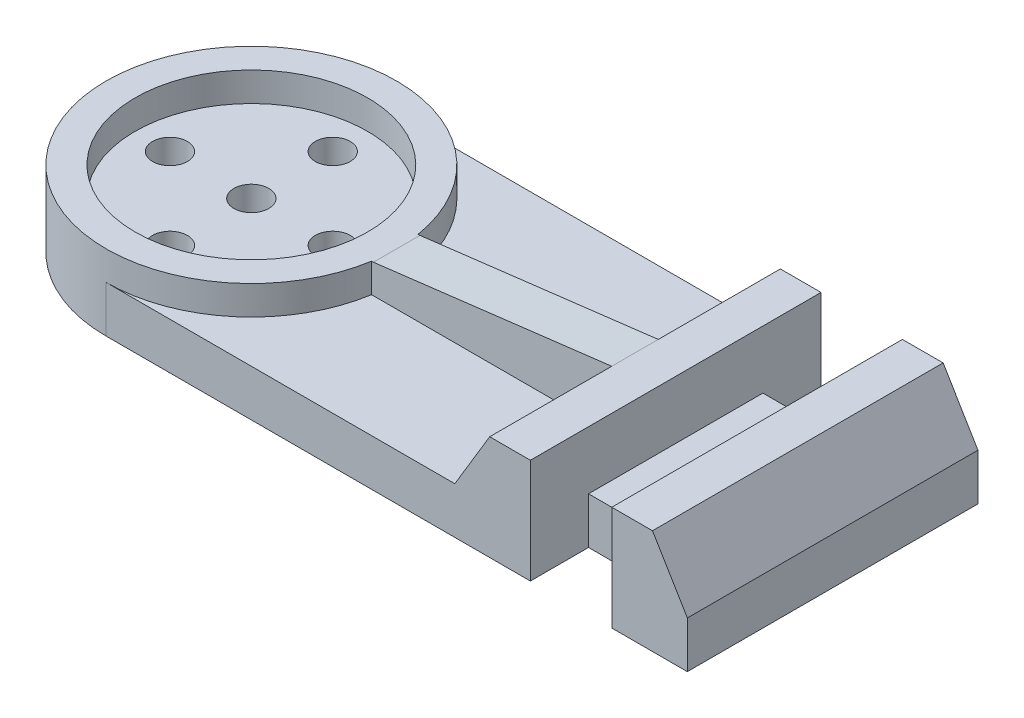
from build123d import *

# Parameters (mm, degrees)
SKETCH_1_R          = 12.5
EXTRUDE_1_DEPTH     = 4
SKETCH_2_R          = 12.5
SKETCH_2_R_2        = 10
EXTRUDE_2_DEPTH     = 2.5
SKETCH_3_R          = 1.5
CUT_EXTRUDE_1_DEPTH = 52.947088465
EXTRUDE_3_DEPTH     = 25
SKETCH_5_W          = 7
SKETCH_5_H          = 5
CUT_EXTRUDE_2_DEPTH = 57.621550668
SKETCH_6_W          = 7
SKETCH_6_H          = 5
CUT_EXTRUDE_3_DEPTH = 52.780787943
EXTRUDE_6_DEPTH     = 2


with BuildPart() as part:
    # 草图1 → 凸台-拉伸1 (new body)
    with BuildSketch(Plane(origin=(0, 0, 0), x_dir=(1, 0, 0), z_dir=(0, 1, 0))):
        Circle(SKETCH_1_R)
        with BuildLine():
            Line((50, 12.5), (0, 12.5))
            ThreePointArc((0, 12.5), (8.838834765, 8.838834765), (12.5, 0))
            ThreePointArc((12.5, 0), (8.838834765, -8.838834765), (0, -12.5))
            Line((0, -12.5), (50, -12.5))
            Line((50, -12.5), (50, 12.5))
        make_face()
    extrude(amount=EXTRUDE_1_DEPTH)

    # 草图2 → 凸台-拉伸2 (add)
    with BuildSketch(Plane(origin=(0, 4, 0), x_dir=(1, 0, 0), z_dir=(0, 1, 0))):
        with Locations(Location((0, 0, 0), (0, 0, 270))):
            Circle(SKETCH_2_R)
        with Locations(Location((0, 0, 0), (0, 0, 270))):
            Circle(SKETCH_2_R_2, mode=Mode.SUBTRACT)
    extrude(amount=EXTRUDE_2_DEPTH)

    # 草图3 → 切除-拉伸1 (cut, through all)
    with BuildSketch(Plane.XZ):
        with Locations(Location((0, 0, 0), (0, 0, 270))):
            Circle(SKETCH_3_R)
        with Locations(Location((0, 7, 0), (0, 0, 270))):
            Circle(SKETCH_3_R)
        with Locations(Location((7, 0, 0), (0, 0, 270))):
            Circle(SKETCH_3_R)
        with Locations(Location((0, -7, 0), (0, 0, 270))):
            Circle(SKETCH_3_R)
        with Locations(Location((-7, 0, 0), (0, 0, 270))):
            Circle(SKETCH_3_R)
        with Locations(Location((40, 0, 0), (0, 0, 270))):
            Circle(SKETCH_3_R)
    extrude(amount=-CUT_EXTRUDE_1_DEPTH, mode=Mode.SUBTRACT)

    # 草图4 → 凸台-拉伸3 (add)
    with BuildSketch(Plane.XY.offset(12.5)):
        Polygon((50, 4), (47, 9), (33, 9), (30, 4), align=None)
    extrude(amount=-EXTRUDE_3_DEPTH)

    # 草图5 → 切除-拉伸2 (cut, through all)
    with BuildSketch(Plane.XY.offset(12.5)):
        with Locations((40, 6.5)):
            Rectangle(SKETCH_5_W, SKETCH_5_H)
    extrude(amount=-CUT_EXTRUDE_2_DEPTH, mode=Mode.SUBTRACT)

    # 草图6 → 切除-拉伸3 (cut, through all)
    with BuildSketch(Plane(origin=(0, 4, 0), x_dir=(1, 0, 0), z_dir=(0, 1, 0))):
        with Locations((40, -10)):
            Rectangle(SKETCH_6_W, SKETCH_6_H)
        with Locations((40, 10)):
            Rectangle(SKETCH_6_W, SKETCH_6_H)
    extrude(amount=-CUT_EXTRUDE_3_DEPTH, mode=Mode.SUBTRACT)

    # 草图7 → 凸台-拉伸6 (add, symmetric)
    with BuildSketch(Plane.XY):
        Polygon((30, 4), (33, 9), (12.5, 6.5), (10.351420614, 6.5), (10.351420614, 4), align=None)
    extrude(amount=EXTRUDE_6_DEPTH, both=True)


solid = part.part
